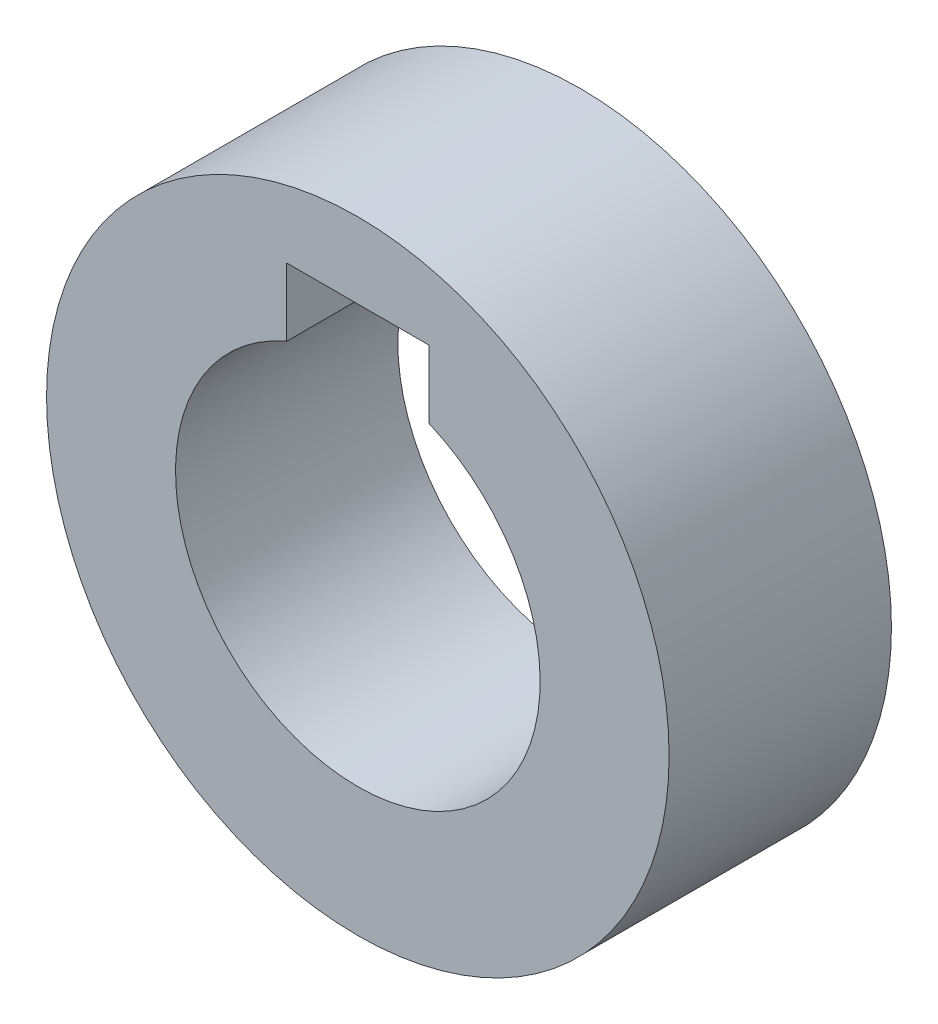
from build123d import *

# Parameters (mm, degrees)
SKETCH1_R           = 7
BOSS_EXTRUDE1_DEPTH = 5


with BuildPart() as part:
    # Sketch1 → Boss-Extrude1 (new body)
    with BuildSketch(Plane.XY):
        Circle(SKETCH1_R)
        with BuildLine():
            Line((-1.6, 3.774917218), (-1.6, 5.3))
            Line((-1.6, 5.3), (1.6, 5.3))
            Line((1.6, 5.3), (1.6, 3.774917218))
            ThreePointArc((1.6, 3.774917218), (0, -4.1), (-1.6, 3.774917218))
        make_face(mode=Mode.SUBTRACT)
    extrude(amount=BOSS_EXTRUDE1_DEPTH)


solid = part.part
